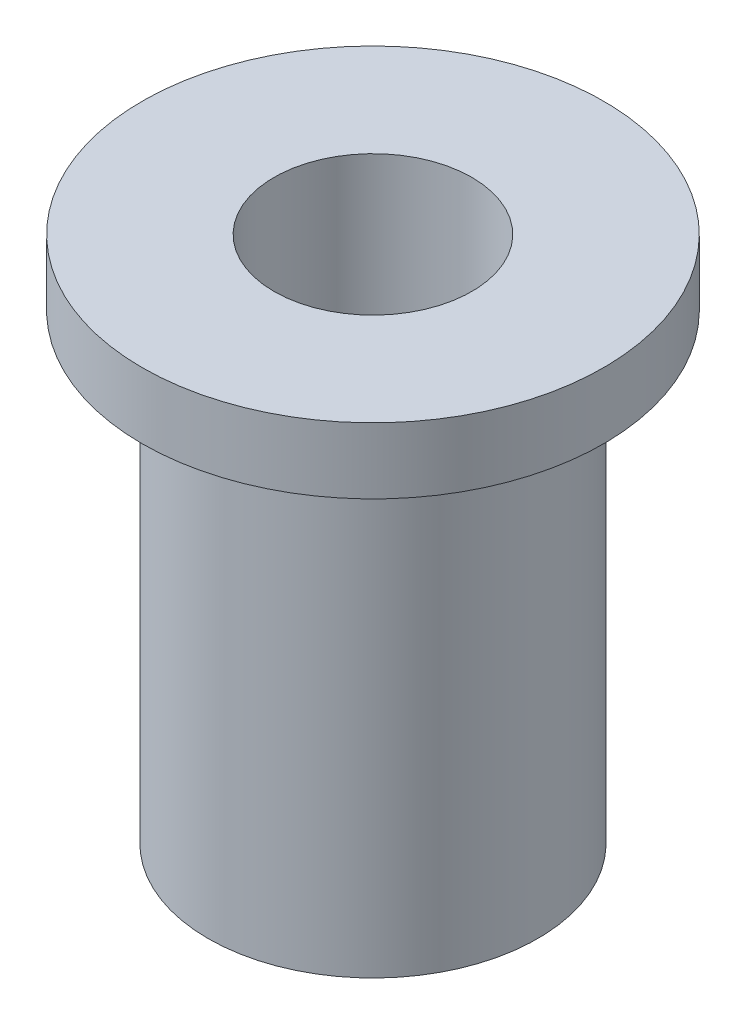
from build123d import *

# Parameters (mm, degrees)
SKETCH1_R           = 3.96875
SKETCH1_R_2         = 2.38125
BOSS_EXTRUDE1_DEPTH = 12.7
BOSS_EXTRUDE2_START = -1.5875
SKETCH2_R           = 5.55625
SKETCH2_R_2         = 2.38125
BOSS_EXTRUDE2_DEPTH = 1.5875


with BuildPart() as part:
    # Sketch1 → Boss-Extrude1 (new body)
    with BuildSketch(Plane(origin=(0, 0, 0), x_dir=(1, 0, 0), z_dir=(0, 1, 0))):
        with Locations(Location((0, 0, 0), (0, 0, 270))):
            Circle(SKETCH1_R)
        with Locations(Location((0, 0, 0), (0, 0, 270))):
            Circle(SKETCH1_R_2, mode=Mode.SUBTRACT)
    extrude(amount=BOSS_EXTRUDE1_DEPTH)

    # Sketch2 → Boss-Extrude2 (add)
    with BuildSketch(Plane(origin=(0, 12.7, 0), x_dir=(1, 0, 0), z_dir=(0, 1, 0)).offset(BOSS_EXTRUDE2_START)):
        with Locations(Location((0, 0, 0), (0, 0, 270))):
            Circle(SKETCH2_R)
        with Locations(Location((0, 0, 0), (0, 0, 270))):
            Circle(SKETCH2_R_2, mode=Mode.SUBTRACT)
    extrude(amount=BOSS_EXTRUDE2_DEPTH)


solid = part.part
